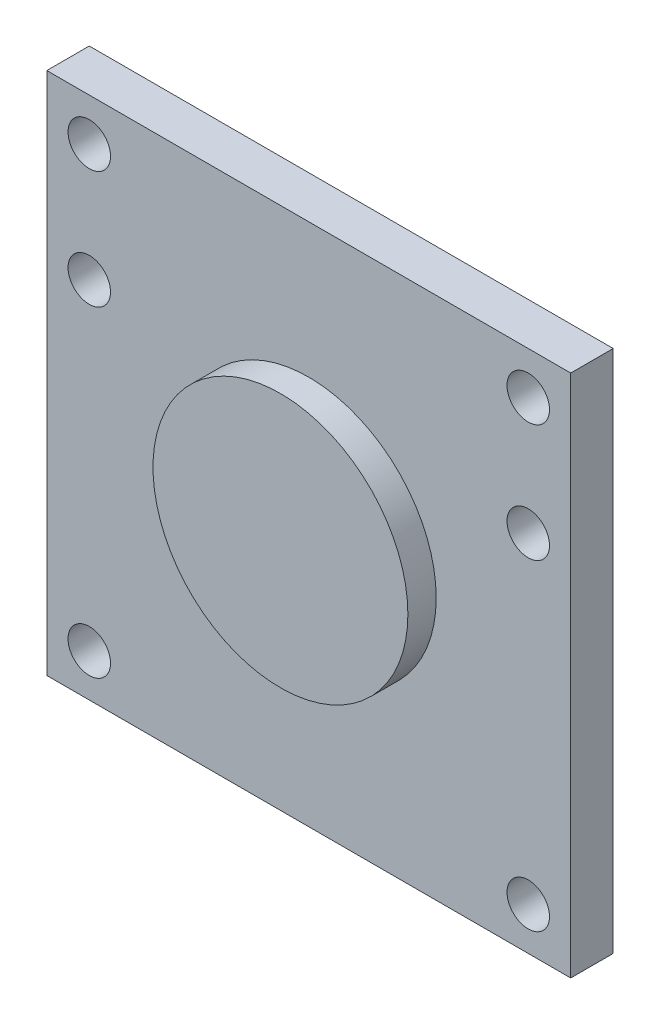
from build123d import *

# Parameters (mm, degrees)
SKETCH1_W           = 37
SKETCH1_H           = 37
SKETCH1_R           = 1.5
BOSS_EXTRUDE1_DEPTH = 3
SKETCH2_R           = 9
BOSS_EXTRUDE2_DEPTH = 2


with BuildPart() as part:
    # Sketch1 → Boss-Extrude1 (new body)
    with BuildSketch(Plane.XY):
        Rectangle(SKETCH1_W, SKETCH1_H)
        with Locations((15.5, 7.2)):
            Circle(SKETCH1_R, mode=Mode.SUBTRACT)
        with Locations((-15.5, 7.2)):
            Circle(SKETCH1_R, mode=Mode.SUBTRACT)
        with Locations((-15.5, 15.5)):
            Circle(SKETCH1_R, mode=Mode.SUBTRACT)
        with Locations((15.5, 15.5)):
            Circle(SKETCH1_R, mode=Mode.SUBTRACT)
        with Locations((15.5, -15.5)):
            Circle(SKETCH1_R, mode=Mode.SUBTRACT)
        with Locations((-15.5, -15.5)):
            Circle(SKETCH1_R, mode=Mode.SUBTRACT)
    extrude(amount=BOSS_EXTRUDE1_DEPTH)

    # Sketch2 → Boss-Extrude2 (add)
    with BuildSketch(Plane.XY.offset(3)):
        Circle(SKETCH2_R)
    extrude(amount=BOSS_EXTRUDE2_DEPTH)


solid = part.part
